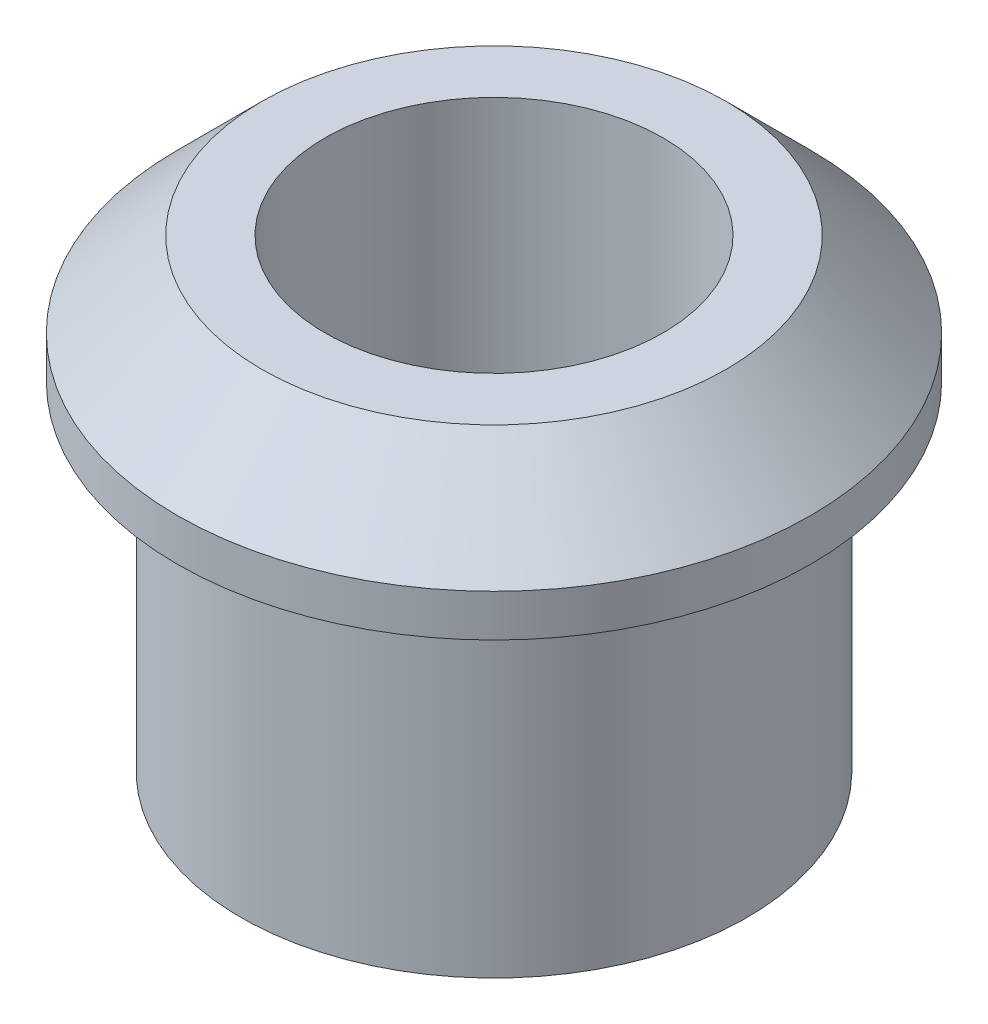
from build123d import *


with BuildPart() as part:
    # Sketch1 → Revolve1 (revolve)
    with BuildSketch(Plane.XY):
        Polygon((4.005, 0), (4.005, 11), (5.5, 11), (7.5, 9), (7.5, 8), (5.995, 8), (5.995, 0), align=None)
    revolve(axis=Axis((0, 0, 0), (0, 1, 0)))


solid = part.part
